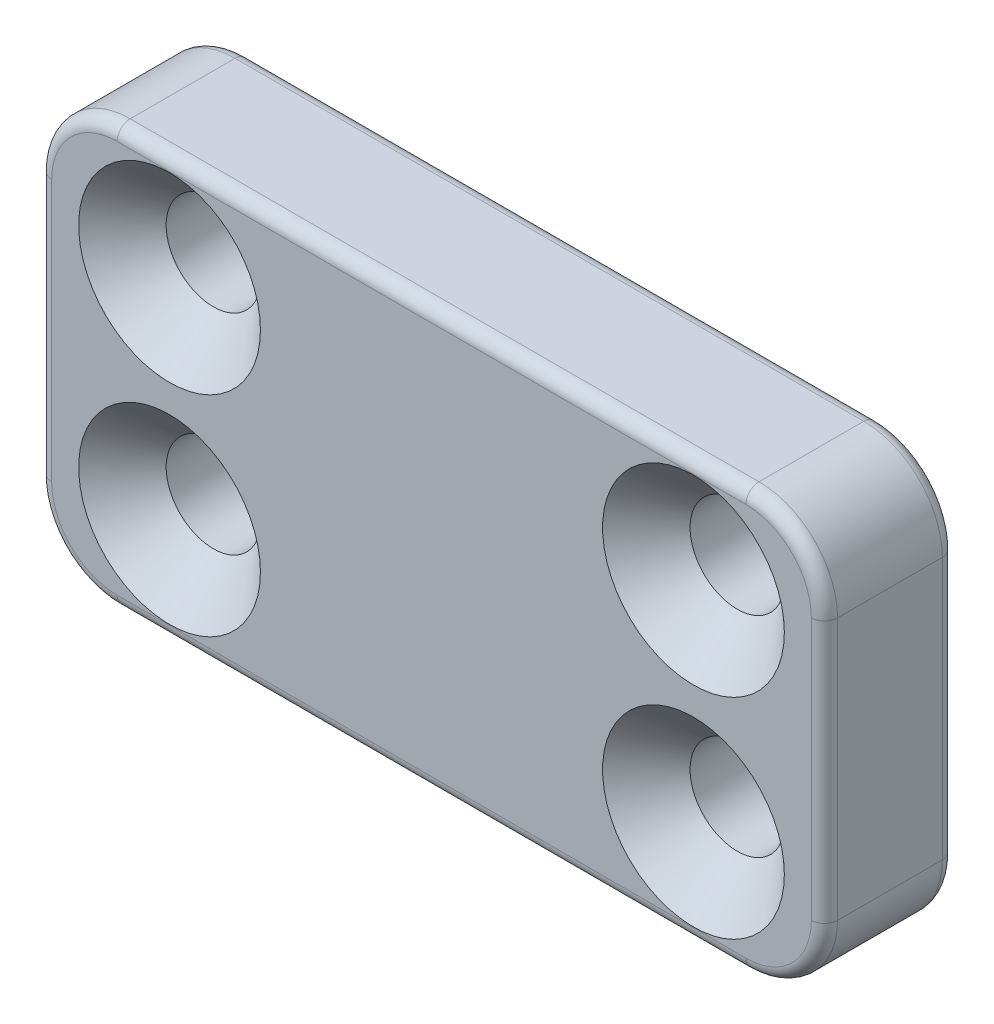
from build123d import *

# Parameters (mm, degrees)
SKETCH1_W                                            = 30
SKETCH1_H                                            = 16
BOSS_EXTRUDE1_DEPTH                                  = 5
CSK_FOR_M3_HEX_SOCKET_COUNTERSUNK_HEAD_S_D           = 3.6
CSK_FOR_M3_HEX_SOCKET_COUNTERSUNK_HEAD_S_CSINK_D     = 6.94
CSK_FOR_M3_HEX_SOCKET_COUNTERSUNK_HEAD_S_CSINK_ANGLE = 90
FILLET1_R                                            = 3
FILLET2_R                                            = 0.5


with BuildPart() as part:
    # Sketch1 → Boss-Extrude1 (new body)
    with BuildSketch(Plane.XY):
        with Locations((15, 8)):
            Rectangle(SKETCH1_W, SKETCH1_H)
    extrude(amount=BOSS_EXTRUDE1_DEPTH)

    # CSK for M3 Hex Socket Countersunk Head Screw1 (through all)
    with Locations(Plane.XY.offset(5)):
        with Locations((5, 12), (25, 12), (25, 4), (5, 4)):
            CounterSinkHole(CSK_FOR_M3_HEX_SOCKET_COUNTERSUNK_HEAD_S_D / 2, CSK_FOR_M3_HEX_SOCKET_COUNTERSUNK_HEAD_S_CSINK_D / 2, counter_sink_angle=CSK_FOR_M3_HEX_SOCKET_COUNTERSUNK_HEAD_S_CSINK_ANGLE)

    # Fillet1
    fillet1_edges = [part.edges().sort_by_distance(p)[0] for p in [
        (0, 16, 2.5),
        (30, 16, 2.5),
        (30, 0, 2.5),
        (0, 0, 2.5),
    ]]
    fillet(fillet1_edges, radius=FILLET1_R)

    # Fillet2
    fillet2_edges = [part.edges().sort_by_distance(p)[0] for p in [
        (30, 8, 0),
        (30, 8, 5),
        (0, 8, 0),
        (15, 16, 0),
        (15, 0, 0),
        (0.878679656, 15.121320344, 0),
        (0.878679656, 0.878679656, 0),
        (29.121320344, 15.121320344, 0),
        (29.121320344, 0.878679656, 0),
        (15, 0, 5),
        (0, 8, 5),
        (15, 16, 5),
        (0.878679656, 15.121320344, 5),
        (0.878679656, 0.878679656, 5),
        (29.121320344, 15.121320344, 5),
        (29.121320344, 0.878679656, 5),
    ]]
    fillet(fillet2_edges, radius=FILLET2_R)


solid = part.part
